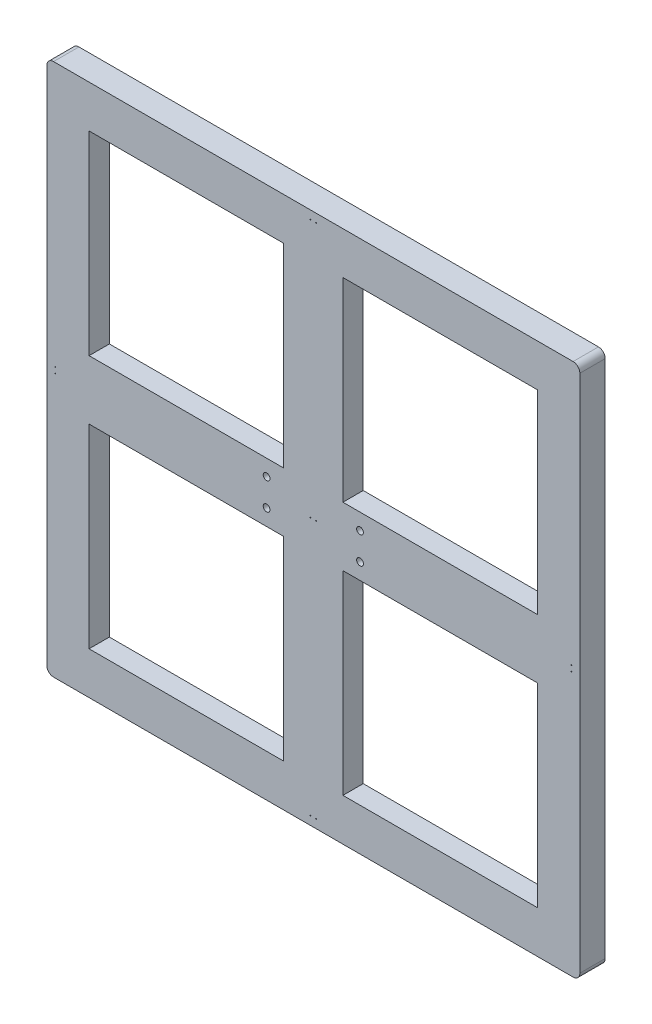
from build123d import *

# Parameters (mm, degrees)
SKETCH1_W           = 145
SKETCH1_H           = 145
BOSS_EXTRUDE2_DEPTH = 7.5
SKETCH3_W           = 145
SKETCH3_H           = 145
SKETCH3_W_2         = 115
SKETCH3_H_2         = 115
BOSS_EXTRUDE4_DEPTH = 12
SKETCH4_R           = 0.275
CUT_EXTRUDE1_DEPTH  = 224.243140992
SKETCH5_R           = 2
CUT_EXTRUDE2_DEPTH  = 224.243140992
FILLET1_R           = 4


with BuildPart() as part:
    # Sketch1 → Boss-Extrude2 (new, symmetric)
    with BuildSketch(Plane.XY):
        Polygon((-157.5, 157.5), (157.5, 157.5), (157.5, -157.5), (-157.5, -157.5), (-157.5, -2.5), (-157.5, 2.5), align=None)
        with Locations((-75, 75)):
            Rectangle(SKETCH1_W, SKETCH1_H, mode=Mode.SUBTRACT)
        with Locations((-75, -75)):
            Rectangle(SKETCH1_W, SKETCH1_H, mode=Mode.SUBTRACT)
        with Locations((75, 75)):
            Rectangle(SKETCH1_W, SKETCH1_H, mode=Mode.SUBTRACT)
        with Locations((75, -75)):
            Rectangle(SKETCH1_W, SKETCH1_H, mode=Mode.SUBTRACT)
    extrude(amount=BOSS_EXTRUDE2_DEPTH, both=True)

    # Sketch3 → Boss-Extrude4 (add)
    # profile 1 of 4: a face of its own
    with BuildSketch(Plane.XY.offset(7.5)):
        with Locations((-75, -75)):
            Rectangle(SKETCH3_W, SKETCH3_H)
        with Locations((-75, -75)):
            Rectangle(SKETCH3_W_2, SKETCH3_H_2, mode=Mode.SUBTRACT)
    # profile 2 of 4: a face of its own
    with BuildSketch(Plane.XY.offset(7.5)):
        with Locations((75, -75)):
            Rectangle(SKETCH3_W, SKETCH3_H)
        with Locations((75, -75)):
            Rectangle(SKETCH3_W_2, SKETCH3_H_2, mode=Mode.SUBTRACT)
    # profile 3 of 4: a face of its own
    with BuildSketch(Plane.XY.offset(7.5)):
        with Locations((75, 75)):
            Rectangle(SKETCH3_W, SKETCH3_H)
        with Locations((75, 75)):
            Rectangle(SKETCH3_W_2, SKETCH3_H_2, mode=Mode.SUBTRACT)
    # profile 4 of 4: a face of its own
    with BuildSketch(Plane.XY.offset(7.5)):
        with Locations((-75, 75)):
            Rectangle(SKETCH3_W, SKETCH3_H)
        with Locations((-75, 75)):
            Rectangle(SKETCH3_W_2, SKETCH3_H_2, mode=Mode.SUBTRACT)
    extrude(amount=-BOSS_EXTRUDE4_DEPTH)

    # Sketch4 → Cut-Extrude1 (cut, through all)
    with BuildSketch(Plane(origin=(0, 0, -7.5), x_dir=(-1, 0, 0), z_dir=(0, 0, -1))):
        with Locations((-1.7, 152.5)):
            Circle(SKETCH4_R)
        with Locations((1.7, 152.5)):
            Circle(SKETCH4_R)
        with Locations((-1.7, 0)):
            Circle(SKETCH4_R)
        with Locations((1.7, 0)):
            Circle(SKETCH4_R)
        with Locations((-152.5, 1.7)):
            Circle(SKETCH4_R)
        with Locations((-152.5, -1.7)):
            Circle(SKETCH4_R)
        with Locations(Location((1.7, -152.5, 0), (0, 0, 180))):
            Circle(SKETCH4_R)
        with Locations(Location((-1.7, -152.5, 0), (0, 0, 180))):
            Circle(SKETCH4_R)
        with Locations(Location((152.5, -1.7, 0), (0, 0, 180))):
            Circle(SKETCH4_R)
        with Locations(Location((152.5, 1.7, 0), (0, 0, 180))):
            Circle(SKETCH4_R)
    extrude(amount=-CUT_EXTRUDE1_DEPTH, mode=Mode.SUBTRACT)

    # Sketch5 → Cut-Extrude2 (cut, through all)
    with BuildSketch(Plane.XY.offset(7.5)):
        with Locations((-27.6, -8)):
            Circle(SKETCH5_R)
        with Locations((-27.6, 8)):
            Circle(SKETCH5_R)
        with Locations((27.6, 8)):
            Circle(SKETCH5_R)
        with Locations((27.6, -8)):
            Circle(SKETCH5_R)
    extrude(amount=-CUT_EXTRUDE2_DEPTH, mode=Mode.SUBTRACT)

    # Fillet1
    fillet1_edges = [part.edges().sort_by_distance(p)[0] for p in [
        (-157.5, 157.5, 0),
        (157.5, 157.5, 0),
        (157.5, -157.5, 0),
        (-157.5, -157.5, 0),
    ]]
    fillet(fillet1_edges, radius=FILLET1_R)


solid = part.part
